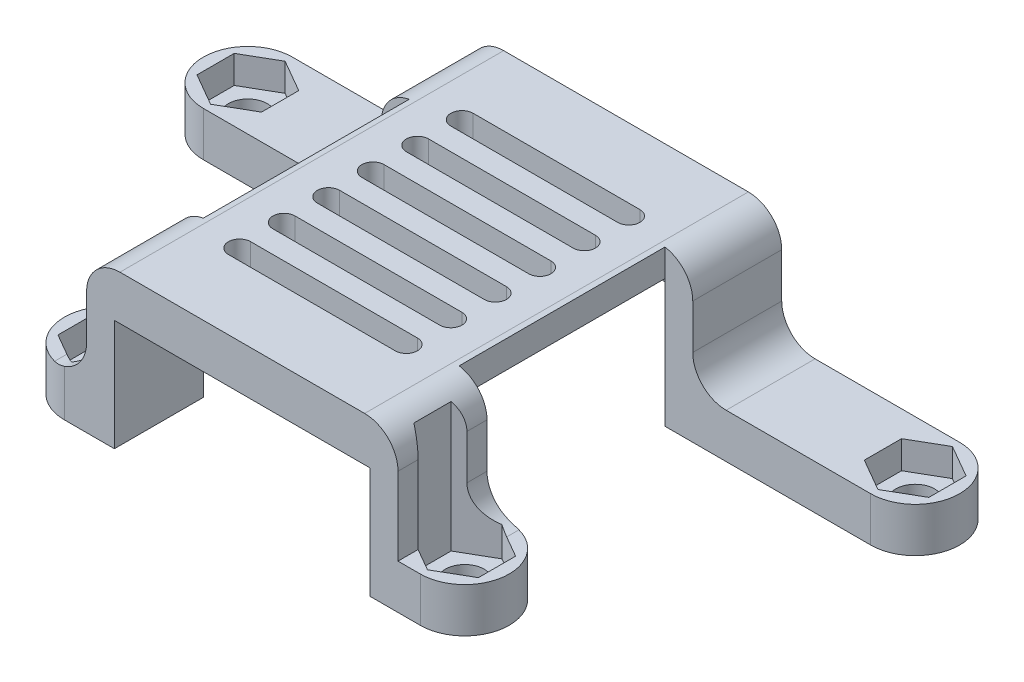
from build123d import *

# Parameters (mm, degrees)
SKETCH1_R           = 4
SKETCH1_R_2         = 1.75
BOSS_EXTRUDE1_DEPTH = 11.5
SKETCH2_R           = 1.75
BOSS_EXTRUDE2_DEPTH = 2.5
CUT_EXTRUDE1_START  = -10
SKETCH3_R           = 1.75
CUT_EXTRUDE1_DEPTH  = 10
CUT_EXTRUDE2_DEPTH  = 12.5
SKETCH5_W           = 23
SKETCH5_H           = 4
SKETCH5_H_2         = 6.75
BOSS_EXTRUDE3_DEPTH = 1.5
FILLET1_R           = 3
CUT_EXTRUDE3_REACH  = 49.773


with BuildPart() as part:
    # Sketch1 → Boss-Extrude1 (new body)
    # profile 1 of 8: a face of its own
    with BuildSketch(Plane(origin=(0, 0, 0), x_dir=(1, 0, 0), z_dir=(0, 1, 0))):
        with Locations((-30, 26.5)):
            Circle(SKETCH1_R)
        with Locations(Location((-30, 26.5, 0), (0, 0, 270))):
            Circle(SKETCH1_R_2, mode=Mode.SUBTRACT)
    # profile 2 of 8: a face of its own
    with BuildSketch(Plane(origin=(0, 0, 0), x_dir=(1, 0, 0), z_dir=(0, 1, 0))):
        with BuildLine():
            Line((-30, 22.5), (-11.5, 22.5))
            Line((-11.5, 22.5), (-11.5, 30.5))
            Line((-11.5, 30.5), (-30, 30.5))
            ThreePointArc((-30, 30.5), (-27.171572875, 29.328427125), (-26, 26.5))
            ThreePointArc((-26, 26.5), (-27.171572875, 23.671572875), (-30, 22.5))
        make_face()
    # profile 3 of 8: a face of its own
    with BuildSketch(Plane(origin=(0, 0, 0), x_dir=(1, 0, 0), z_dir=(0, 1, 0))):
        with BuildLine():
            Line((11.5, 30.5), (11.5, 22.5))
            Line((11.5, 22.5), (30, 22.5))
            ThreePointArc((30, 22.5), (26, 26.5), (30, 30.5))
            Line((30, 30.5), (11.5, 30.5))
        make_face()
    # profile 4 of 8: a face of its own
    with BuildSketch(Plane(origin=(0, 0, 0), x_dir=(1, 0, 0), z_dir=(0, 1, 0))):
        with Locations((30, 26.5)):
            Circle(SKETCH1_R)
        with Locations(Location((30, 26.5, 0), (0, 0, 270))):
            Circle(SKETCH1_R_2, mode=Mode.SUBTRACT)
    # profile 5 of 8: a face of its own
    with BuildSketch(Plane(origin=(0, 0, 0), x_dir=(1, 0, 0), z_dir=(0, 1, 0))):
        with Locations((16, 0)):
            Circle(SKETCH1_R)
        with Locations(Location((16, 0, 0), (0, 0, 270))):
            Circle(SKETCH1_R_2, mode=Mode.SUBTRACT)
    # profile 6 of 8: a face of its own
    with BuildSketch(Plane(origin=(0, 0, 0), x_dir=(1, 0, 0), z_dir=(0, 1, 0))):
        with BuildLine():
            Line((11.5, 4), (11.5, -4))
            Line((11.5, -4), (16, -4))
            ThreePointArc((16, -4), (12, 0), (16, 4))
            Line((16, 4), (11.5, 4))
        make_face()
    # profile 7 of 8: a face of its own
    with BuildSketch(Plane(origin=(0, 0, 0), x_dir=(1, 0, 0), z_dir=(0, 1, 0))):
        with BuildLine():
            Line((-16, -4), (-11.5, -4))
            Line((-11.5, -4), (-11.5, 4))
            Line((-11.5, 4), (-16, 4))
            ThreePointArc((-16, 4), (-13.171572875, 2.828427125), (-12, 0))
            ThreePointArc((-12, 0), (-13.171572875, -2.828427125), (-16, -4))
        make_face()
    # profile 8 of 8: a face of its own
    with BuildSketch(Plane(origin=(0, 0, 0), x_dir=(1, 0, 0), z_dir=(0, 1, 0))):
        with Locations((-16, 0)):
            Circle(SKETCH1_R)
        with Locations(Location((-16, 0, 0), (0, 0, 270))):
            Circle(SKETCH1_R_2, mode=Mode.SUBTRACT)
    extrude(amount=BOSS_EXTRUDE1_DEPTH)

    # Sketch2 → Boss-Extrude2 (add)
    # profile 1 of 5: a face of its own
    with BuildSketch(Plane(origin=(0, 11.5, 0), x_dir=(1, 0, 0), z_dir=(0, 1, 0))):
        with BuildLine():
            Line((-11.5, 30.5), (-30, 30.5))
            ThreePointArc((-30, 30.5), (-34, 26.5), (-30, 22.5))
            Line((-30, 22.5), (-11.5, 22.5))
            Line((-11.5, 22.5), (-11.5, 30.5))
        make_face()
        with Locations(Location((-30, 26.5, 0), (0, 0, 270))):
            Circle(SKETCH2_R, mode=Mode.SUBTRACT)
    # profile 2 of 5: a face of its own
    with BuildSketch(Plane(origin=(0, 11.5, 0), x_dir=(1, 0, 0), z_dir=(0, 1, 0))):
        Polygon((11.5, 30.5), (-11.5, 30.5), (-11.5, 22.5), (-11.5, 4), (-11.5, -4), (11.5, -4), (11.5, 4), (11.5, 22.5), align=None)
    # profile 3 of 5: a face of its own
    with BuildSketch(Plane(origin=(0, 11.5, 0), x_dir=(1, 0, 0), z_dir=(0, 1, 0))):
        with BuildLine():
            Line((30, 30.5), (11.5, 30.5))
            Line((11.5, 30.5), (11.5, 22.5))
            Line((11.5, 22.5), (30, 22.5))
            ThreePointArc((30, 22.5), (34, 26.5), (30, 30.5))
        make_face()
        with Locations(Location((30, 26.5, 0), (0, 0, 270))):
            Circle(SKETCH2_R, mode=Mode.SUBTRACT)
    # profile 4 of 5: a face of its own
    with BuildSketch(Plane(origin=(0, 11.5, 0), x_dir=(1, 0, 0), z_dir=(0, 1, 0))):
        with BuildLine():
            Line((16, 4), (11.5, 4))
            Line((11.5, 4), (11.5, -4))
            Line((11.5, -4), (16, -4))
            ThreePointArc((16, -4), (20, 0), (16, 4))
        make_face()
        with Locations(Location((16, 0, 0), (0, 0, 270))):
            Circle(SKETCH2_R, mode=Mode.SUBTRACT)
    # profile 5 of 5: a face of its own
    with BuildSketch(Plane(origin=(0, 11.5, 0), x_dir=(1, 0, 0), z_dir=(0, 1, 0))):
        with BuildLine():
            Line((-11.5, -4), (-11.5, 4))
            Line((-11.5, 4), (-16, 4))
            ThreePointArc((-16, 4), (-20, 0), (-16, -4))
            Line((-16, -4), (-11.5, -4))
        make_face()
        with Locations(Location((-16, 0, 0), (0, 0, 270))):
            Circle(SKETCH2_R, mode=Mode.SUBTRACT)
    extrude(amount=BOSS_EXTRUDE2_DEPTH)

    # Sketch3 → Cut-Extrude1 (cut)
    # profile 1 of 10: a face of its own
    with BuildSketch(Plane(origin=(0, 14, 0), x_dir=(1, 0, 0), z_dir=(0, 1, 0)).offset(CUT_EXTRUDE1_START)):
        with BuildLine():
            ThreePointArc((-26, 26.5), (-27.171572875, 29.328427125), (-30, 30.5))
            ThreePointArc((-30, 30.5), (-34, 26.5), (-30, 22.5))
            ThreePointArc((-30, 22.5), (-27.171572875, 23.671572875), (-26, 26.5))
        make_face()
        with Locations(Location((-30, 26.5, 0), (0, 0, 270))):
            Circle(SKETCH3_R, mode=Mode.SUBTRACT)
    # profile 2 of 10: a face of its own
    with BuildSketch(Plane(origin=(0, 14, 0), x_dir=(1, 0, 0), z_dir=(0, 1, 0)).offset(CUT_EXTRUDE1_START)):
        with BuildLine():
            Line((-14, 22.5), (-14, 30.5))
            Line((-14, 30.5), (-30, 30.5))
            ThreePointArc((-30, 30.5), (-27.171572875, 29.328427125), (-26, 26.5))
            ThreePointArc((-26, 26.5), (-27.171572875, 23.671572875), (-30, 22.5))
            Line((-30, 22.5), (-14, 22.5))
        make_face()
    # profile 3 of 10: a face of its own
    with BuildSketch(Plane(origin=(0, 14, 0), x_dir=(1, 0, 0), z_dir=(0, 1, 0)).offset(CUT_EXTRUDE1_START)):
        with BuildLine():
            Line((30, 30.5), (14, 30.5))
            Line((14, 30.5), (14, 22.5))
            Line((14, 22.5), (30, 22.5))
            ThreePointArc((30, 22.5), (26, 26.5), (30, 30.5))
        make_face()
    # profile 4 of 10: a face of its own
    with BuildSketch(Plane(origin=(0, 14, 0), x_dir=(1, 0, 0), z_dir=(0, 1, 0)).offset(CUT_EXTRUDE1_START)):
        with BuildLine():
            ThreePointArc((34, 26.5), (32.828427125, 29.328427125), (30, 30.5))
            ThreePointArc((30, 30.5), (26, 26.5), (30, 22.5))
            ThreePointArc((30, 22.5), (32.828427125, 23.671572875), (34, 26.5))
        make_face()
        with Locations(Location((30, 26.5, 0), (0, 0, 270))):
            Circle(SKETCH3_R, mode=Mode.SUBTRACT)
    # profile 5 of 10: a face of its own
    with BuildSketch(Plane(origin=(0, 14, 0), x_dir=(1, 0, 0), z_dir=(0, 1, 0)).offset(CUT_EXTRUDE1_START)):
        with BuildLine():
            ThreePointArc((16, 4), (14.96472382, 3.863703305), (14, 3.464101615))
            Line((14, 3.464101615), (14, -3.464101615))
            ThreePointArc((14, -3.464101615), (14.96472382, -3.863703305), (16, -4))
            ThreePointArc((16, -4), (18.828427125, -2.828427125), (20, 0))
            ThreePointArc((20, 0), (18.828427125, 2.828427125), (16, 4))
        make_face()
        with Locations(Location((16, 0, 0), (0, 0, 270))):
            Circle(SKETCH3_R, mode=Mode.SUBTRACT)
    # profile 6 of 10: a face of its own
    with BuildSketch(Plane(origin=(0, 14, 0), x_dir=(1, 0, 0), z_dir=(0, 1, 0)).offset(CUT_EXTRUDE1_START)):
        with BuildLine():
            Line((-14, -3.464101615), (-14, 3.464101615))
            ThreePointArc((-14, 3.464101615), (-14.96472382, 3.863703305), (-16, 4))
            ThreePointArc((-16, 4), (-20, 0), (-16, -4))
            ThreePointArc((-16, -4), (-14.96472382, -3.863703305), (-14, -3.464101615))
        make_face()
        with Locations(Location((-16, 0, 0), (0, 0, 270))):
            Circle(SKETCH3_R, mode=Mode.SUBTRACT)
    # profile 7 of 10: a face of its own
    with BuildSketch(Plane(origin=(0, 14, 0), x_dir=(1, 0, 0), z_dir=(0, 1, 0)).offset(CUT_EXTRUDE1_START)):
        with BuildLine():
            Line((-14, -4), (-14, -3.464101615))
            ThreePointArc((-14, -3.464101615), (-14.96472382, -3.863703305), (-16, -4))
            Line((-16, -4), (-14, -4))
        make_face()
    # profile 8 of 10: a face of its own
    with BuildSketch(Plane(origin=(0, 14, 0), x_dir=(1, 0, 0), z_dir=(0, 1, 0)).offset(CUT_EXTRUDE1_START)):
        with BuildLine():
            Line((-14, 3.464101615), (-14, 4))
            Line((-14, 4), (-16, 4))
            ThreePointArc((-16, 4), (-14.96472382, 3.863703305), (-14, 3.464101615))
        make_face()
    # profile 9 of 10: a face of its own
    with BuildSketch(Plane(origin=(0, 14, 0), x_dir=(1, 0, 0), z_dir=(0, 1, 0)).offset(CUT_EXTRUDE1_START)):
        with BuildLine():
            Line((16, 4), (14, 4))
            Line((14, 4), (14, 3.464101615))
            ThreePointArc((14, 3.464101615), (14.96472382, 3.863703305), (16, 4))
        make_face()
    # profile 10 of 10: a face of its own
    with BuildSketch(Plane(origin=(0, 14, 0), x_dir=(1, 0, 0), z_dir=(0, 1, 0)).offset(CUT_EXTRUDE1_START)):
        with BuildLine():
            ThreePointArc((16, -4), (14.96472382, -3.863703305), (14, -3.464101615))
            Line((14, -3.464101615), (14, -4))
            Line((14, -4), (16, -4))
        make_face()
    extrude(amount=CUT_EXTRUDE1_DEPTH, mode=Mode.SUBTRACT)

    # Sketch4 → Cut-Extrude2 (cut)
    with BuildSketch(Plane(origin=(0, 14, 0), x_dir=(1, 0, 0), z_dir=(0, 1, 0))):
        Polygon((-27.1, 28.174315781), (-30, 29.848631561), (-32.9, 28.174315781), (-32.9, 24.825684219), (-30, 23.151368439), (-27.1, 24.825684219), align=None)
        Polygon((13.1, 1.674315781), (16, 3.348631561), (18.9, 1.674315781), (18.9, -1.674315781), (16, -3.348631561), (13.1, -1.674315781), align=None)
        Polygon((-13.1, 1.674315781), (-16, 3.348631561), (-18.9, 1.674315781), (-18.9, -1.674315781), (-16, -3.348631561), (-13.1, -1.674315781), align=None)
        Polygon((30, 23.151368439), (27.1, 24.825684219), (27.1, 28.174315781), (30, 29.848631561), (32.9, 28.174315781), (32.9, 24.825684219), align=None)
    extrude(amount=-CUT_EXTRUDE2_DEPTH, mode=Mode.SUBTRACT)

    # Sketch5 → Boss-Extrude3 (add)
    with BuildSketch(Plane.XZ.offset(-11.5)):
        with Locations((0, 2)):
            Rectangle(SKETCH5_W, SKETCH5_H)
        with Locations((0, -27.125)):
            Rectangle(SKETCH5_W, SKETCH5_H_2)
    extrude(amount=BOSS_EXTRUDE3_DEPTH)

    # Fillet1
    fillet1_edges = [part.edges().sort_by_distance(p)[0] for p in [
        (14, 4, -26.5),
        (14, 14, -3.096965511),
        (14, 4, -3.096965511),
        (-14, 14, 3.096965511),
        (-14, 4, 3.096965511),
        (-14, 4, -3.096965511),
        (-14, 4, -26.5),
    ]]
    fillet(fillet1_edges, radius=FILLET1_R)

    # Sketch6 → Cut-Extrude3 (cut, up to next)
    with BuildSketch(Plane(origin=(0, 14, 0), x_dir=(1, 0, 0), z_dir=(0, 1, 0)), mode=Mode.PRIVATE) as cut_extrude3_sk1:
        with BuildLine():
            Line((-7.5, 24.25), (7.5, 24.25))
            ThreePointArc((7.5, 24.25), (8.5, 23.25), (7.5, 22.25))
            Line((7.5, 22.25), (-7.5, 22.25))
            ThreePointArc((-7.5, 22.25), (-8.5, 23.25), (-7.5, 24.25))
        make_face()
    cut_extrude3_tool1 = extrude(cut_extrude3_sk1.sketch, amount=-CUT_EXTRUDE3_REACH, mode=Mode.PRIVATE) & part.part
    # Sketch6 → Cut-Extrude3 (cut, up to next)
    with BuildSketch(Plane(origin=(0, 14, 0), x_dir=(1, 0, 0), z_dir=(0, 1, 0)), mode=Mode.PRIVATE) as cut_extrude3_sk2:
        with BuildLine():
            Line((-7.5, 20.25), (7.5, 20.25))
            ThreePointArc((7.5, 20.25), (8.5, 19.25), (7.5, 18.25))
            Line((7.5, 18.25), (-7.5, 18.25))
            ThreePointArc((-7.5, 18.25), (-8.5, 19.25), (-7.5, 20.25))
        make_face()
    cut_extrude3_tool2 = extrude(cut_extrude3_sk2.sketch, amount=-CUT_EXTRUDE3_REACH, mode=Mode.PRIVATE) & part.part
    # Sketch6 → Cut-Extrude3 (cut, up to next)
    with BuildSketch(Plane(origin=(0, 14, 0), x_dir=(1, 0, 0), z_dir=(0, 1, 0)), mode=Mode.PRIVATE) as cut_extrude3_sk3:
        with BuildLine():
            Line((-7.5, 16.25), (7.5, 16.25))
            ThreePointArc((7.5, 16.25), (8.5, 15.25), (7.5, 14.25))
            Line((7.5, 14.25), (-7.5, 14.25))
            ThreePointArc((-7.5, 14.25), (-8.5, 15.25), (-7.5, 16.25))
        make_face()
    cut_extrude3_tool3 = extrude(cut_extrude3_sk3.sketch, amount=-CUT_EXTRUDE3_REACH, mode=Mode.PRIVATE) & part.part
    # Sketch6 → Cut-Extrude3 (cut, up to next)
    with BuildSketch(Plane(origin=(0, 14, 0), x_dir=(1, 0, 0), z_dir=(0, 1, 0)), mode=Mode.PRIVATE) as cut_extrude3_sk4:
        with BuildLine():
            Line((-7.5, 12.25), (7.5, 12.25))
            ThreePointArc((7.5, 12.25), (8.5, 11.25), (7.5, 10.25))
            Line((7.5, 10.25), (-7.5, 10.25))
            ThreePointArc((-7.5, 10.25), (-8.5, 11.25), (-7.5, 12.25))
        make_face()
    cut_extrude3_tool4 = extrude(cut_extrude3_sk4.sketch, amount=-CUT_EXTRUDE3_REACH, mode=Mode.PRIVATE) & part.part
    # Sketch6 → Cut-Extrude3 (cut, up to next)
    with BuildSketch(Plane(origin=(0, 14, 0), x_dir=(1, 0, 0), z_dir=(0, 1, 0)), mode=Mode.PRIVATE) as cut_extrude3_sk5:
        with BuildLine():
            Line((-7.5, 8.25), (7.5, 8.25))
            ThreePointArc((7.5, 8.25), (8.5, 7.25), (7.5, 6.25))
            Line((7.5, 6.25), (-7.5, 6.25))
            ThreePointArc((-7.5, 6.25), (-8.5, 7.25), (-7.5, 8.25))
        make_face()
    cut_extrude3_tool5 = extrude(cut_extrude3_sk5.sketch, amount=-CUT_EXTRUDE3_REACH, mode=Mode.PRIVATE) & part.part
    # Sketch6 → Cut-Extrude3 (cut, up to next)
    with BuildSketch(Plane(origin=(0, 14, 0), x_dir=(1, 0, 0), z_dir=(0, 1, 0)), mode=Mode.PRIVATE) as cut_extrude3_sk6:
        with BuildLine():
            Line((-7.5, 4.25), (7.5, 4.25))
            ThreePointArc((7.5, 4.25), (8.5, 3.25), (7.5, 2.25))
            Line((7.5, 2.25), (-7.5, 2.25))
            ThreePointArc((-7.5, 2.25), (-8.5, 3.25), (-7.5, 4.25))
        make_face()
    cut_extrude3_tool6 = extrude(cut_extrude3_sk6.sketch, amount=-CUT_EXTRUDE3_REACH, mode=Mode.PRIVATE) & part.part
    add(cut_extrude3_tool1.solids().sort_by_distance((0, 14, -23.25))[0], mode=Mode.SUBTRACT)
    add(cut_extrude3_tool2.solids().sort_by_distance((0, 14, -19.25))[0], mode=Mode.SUBTRACT)
    add(cut_extrude3_tool3.solids().sort_by_distance((0, 14, -15.25))[0], mode=Mode.SUBTRACT)
    add(cut_extrude3_tool4.solids().sort_by_distance((0, 14, -11.25))[0], mode=Mode.SUBTRACT)
    add(cut_extrude3_tool5.solids().sort_by_distance((0, 14, -7.25))[0], mode=Mode.SUBTRACT)
    add(cut_extrude3_tool6.solids().sort_by_distance((0, 14, -3.25))[0], mode=Mode.SUBTRACT)


solid = part.part
